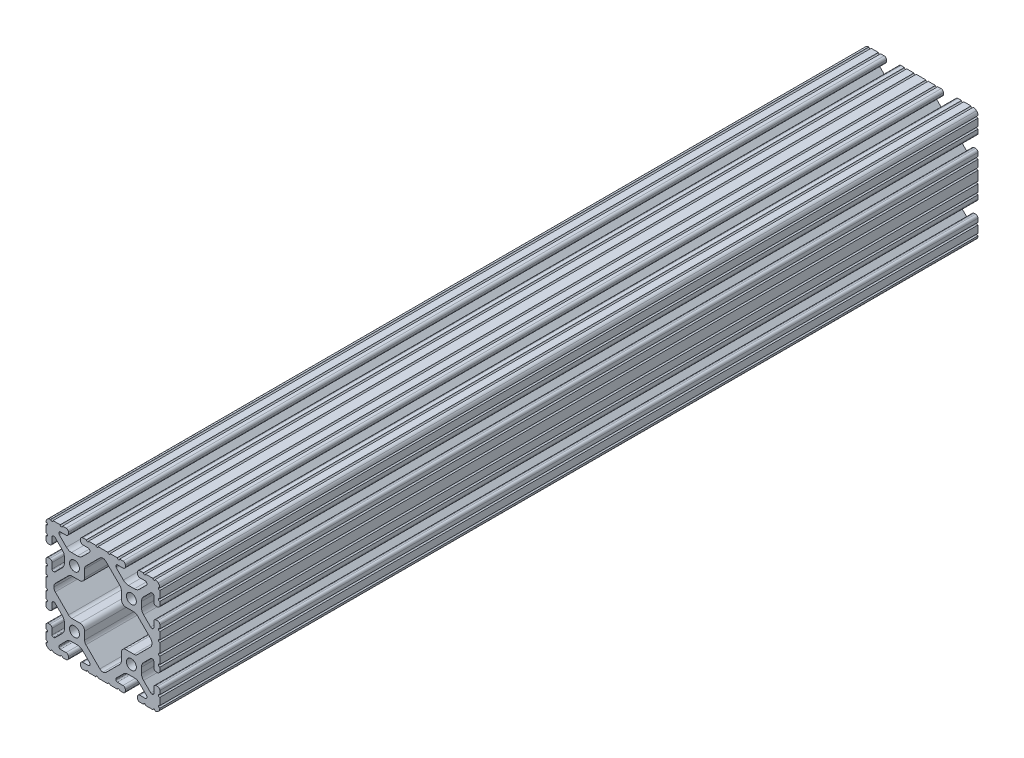
from build123d import *

# Parameters (mm, degrees)
BOSS_EXTRUDE1_DEPTH      = 273.8
BOSS_EXTRUDE1_DEPTH_BACK = 273.8
SKETCH3_R                = 3.3274


with BuildPart() as part:
    # Sketch3 → Boss-Extrude1 (new, two sides: drawn at the far end of the back side and taken through both)
    with BuildSketch(Plane.XY.offset(-BOSS_EXTRUDE1_DEPTH_BACK)):
        with BuildLine():
            Line((34.036, 28.448), (34.036, 24.630196049))
            ThreePointArc((34.036, 24.630196049), (34.497248241, 23.51664429), (35.6108, 23.055396049))
            Line((35.6108, 23.055396049), (36.525200183, 23.055396049))
            ThreePointArc((36.525200183, 23.055396049), (37.638751813, 23.516644236), (38.1, 24.630195866))
            Line((38.1, 24.630195866), (38.1, 27.023826138))
            ThreePointArc((38.1, 27.023826138), (37.117780706, 27.7845421), (38.1, 28.545258062))
            Line((38.1, 28.545258062), (38.1, 33.373016026))
            ThreePointArc((38.1, 33.373016026), (37.141472621, 34.109236774), (38.1, 34.845457521))
            ThreePointArc((38.1, 34.845457521), (37.837757813, 36.120195002), (37.086123144, 37.182631793))
            ThreePointArc((37.086123144, 37.182631793), (36.106286572, 37.843374398), (34.952681874, 38.1))
            ThreePointArc((34.952681874, 38.1), (34.190730434, 37.320215335), (33.428778994, 38.1))
            Line((33.428778994, 38.1), (28.601105935, 38.1))
            ThreePointArc((28.601105935, 38.1), (27.839158581, 37.32021942), (27.077211227, 38.1))
            Line((27.077211227, 38.1), (24.6888, 38.1))
            ThreePointArc((24.6888, 38.1), (23.575248241, 37.638751759), (23.114, 36.5252))
            Line((23.114, 36.5252), (23.114, 35.6108))
            ThreePointArc((23.114, 35.6108), (23.575248241, 34.497248241), (24.6888, 34.036))
            Line((24.6888, 34.036), (28.448, 34.036))
            ThreePointArc((28.448, 34.036), (29.076617928, 33.775617928), (29.337, 33.147))
            Line((29.337, 33.147), (29.337, 32.720693454))
            ThreePointArc((29.337, 32.720693454), (29.326675076, 32.273872751), (29.100231244, 31.888543625))
            Line((29.100231244, 31.888543625), (24.409287499, 27.197588341))
            ThreePointArc((24.409287499, 27.197588341), (22.868340045, 26.167958114), (21.050667579, 25.8064))
            Line((21.050667579, 25.8064), (17.049332421, 25.8064))
            ThreePointArc((17.049332421, 25.8064), (15.231659955, 26.167958114), (13.690712501, 27.197588341))
            Line((13.690712501, 27.197588341), (9.023381298, 31.864931024))
            ThreePointArc((9.023381298, 31.864931024), (8.830670886, 32.153343113), (8.763, 32.493548179))
            Line((8.763, 32.493548179), (8.763, 33.147))
            ThreePointArc((8.763, 33.147), (9.023382072, 33.775617928), (9.652, 34.036))
            Line((9.652, 34.036), (13.4112, 34.036))
            ThreePointArc((13.4112, 34.036), (14.524751759, 34.497248241), (14.986, 35.6108))
            Line((14.986, 35.6108), (14.986, 36.5252))
            ThreePointArc((14.986, 36.5252), (14.524751759, 37.638751759), (13.4112, 38.1))
            Line((13.4112, 38.1), (11.128867074, 38.1))
            ThreePointArc((11.128867074, 38.1), (10.367071033, 37.320370693), (9.605274992, 38.1))
            Line((9.605274992, 38.1), (4.777313069, 38.1))
            ThreePointArc((4.777313069, 38.1), (4.015517029, 37.320370693), (3.253720988, 38.1))
            Line((3.253720988, 38.1), (-3.253720988, 38.1))
            ThreePointArc((-3.253720988, 38.1), (-4.015517029, 37.320370693), (-4.777313069, 38.1))
            Line((-4.777313069, 38.1), (-9.605274992, 38.1))
            ThreePointArc((-9.605274992, 38.1), (-10.367071033, 37.320370693), (-11.128867074, 38.1))
            Line((-11.128867074, 38.1), (-13.4112, 38.1))
            ThreePointArc((-13.4112, 38.1), (-14.524751759, 37.638751759), (-14.986, 36.5252))
            Line((-14.986, 36.5252), (-14.986, 35.6108))
            ThreePointArc((-14.986, 35.6108), (-14.524751759, 34.497248241), (-13.4112, 34.036))
            Line((-13.4112, 34.036), (-9.652, 34.036))
            ThreePointArc((-9.652, 34.036), (-9.023382072, 33.775617928), (-8.763, 33.147))
            Line((-8.763, 33.147), (-8.763, 32.493548179))
            ThreePointArc((-8.763, 32.493548179), (-8.830670886, 32.153343113), (-9.023381298, 31.864931024))
            Line((-9.023381298, 31.864931024), (-13.690712501, 27.197588341))
            ThreePointArc((-13.690712501, 27.197588341), (-15.231659955, 26.167958114), (-17.049332421, 25.8064))
            Line((-17.049332421, 25.8064), (-21.050667579, 25.8064))
            ThreePointArc((-21.050667579, 25.8064), (-22.868340045, 26.167958114), (-24.409287499, 27.197588341))
            Line((-24.409287499, 27.197588341), (-29.100231244, 31.888543625))
            ThreePointArc((-29.100231244, 31.888543625), (-29.326675076, 32.273872751), (-29.337, 32.720693454))
            Line((-29.337, 32.720693454), (-29.337, 33.147))
            ThreePointArc((-29.337, 33.147), (-29.076617928, 33.775617928), (-28.448, 34.036))
            Line((-28.448, 34.036), (-24.6888, 34.036))
            ThreePointArc((-24.6888, 34.036), (-23.575248241, 34.497248241), (-23.114, 35.6108))
            Line((-23.114, 35.6108), (-23.114, 36.5252))
            ThreePointArc((-23.114, 36.5252), (-23.575248241, 37.638751759), (-24.6888, 38.1))
            Line((-24.6888, 38.1), (-27.077211227, 38.1))
            ThreePointArc((-27.077211227, 38.1), (-27.839158581, 37.32021942), (-28.601105935, 38.1))
            Line((-28.601105935, 38.1), (-33.428778994, 38.1))
            ThreePointArc((-33.428778994, 38.1), (-34.190730434, 37.320215335), (-34.952681874, 38.1))
            ThreePointArc((-34.952681874, 38.1), (-36.106286572, 37.843374398), (-37.086123144, 37.182631793))
            ThreePointArc((-37.086123144, 37.182631793), (-37.837757813, 36.120195002), (-38.1, 34.845457521))
            ThreePointArc((-38.1, 34.845457521), (-37.141472621, 34.109236774), (-38.1, 33.373016026))
            Line((-38.1, 33.373016026), (-38.1, 28.545258062))
            ThreePointArc((-38.1, 28.545258062), (-37.117780706, 27.7845421), (-38.1, 27.023826138))
            Line((-38.1, 27.023826138), (-38.1, 24.630195866))
            ThreePointArc((-38.1, 24.630195866), (-37.638751813, 23.516644236), (-36.525200183, 23.055396049))
            Line((-36.525200183, 23.055396049), (-35.6108, 23.055396049))
            ThreePointArc((-35.6108, 23.055396049), (-34.497248241, 23.51664429), (-34.036, 24.630196049))
            Line((-34.036, 24.630196049), (-34.036, 28.448))
            ThreePointArc((-34.036, 28.448), (-33.775617928, 29.076617928), (-33.147, 29.337))
            Line((-33.147, 29.337), (-32.664287242, 29.337))
            ThreePointArc((-32.664287242, 29.337), (-32.324081166, 29.269328695), (-32.03566854, 29.076617155))
            Line((-32.03566854, 29.076617155), (-27.19758008, 24.238516795))
            ThreePointArc((-27.19758008, 24.238516795), (-26.167955879, 22.697572205), (-25.8064, 20.879905136))
            Line((-25.8064, 20.879905136), (-25.8064, 17.220094864))
            ThreePointArc((-25.8064, 17.220094864), (-26.167955879, 15.402427795), (-27.19758008, 13.861483205))
            Line((-27.19758008, 13.861483205), (-31.948944541, 9.110107057))
            ThreePointArc((-31.948944541, 9.110107057), (-32.333417096, 8.853210196), (-32.786933649, 8.763))
            Line((-32.786933649, 8.763), (-33.060275787, 8.763))
            ThreePointArc((-33.060275787, 8.763), (-33.750216995, 9.048783005), (-34.036, 9.738724213))
            Line((-34.036, 9.738724213), (-34.036, 13.469803585))
            ThreePointArc((-34.036, 13.469803585), (-34.497248348, 14.583355603), (-35.610800366, 15.044603951))
            Line((-35.610800366, 15.044603951), (-36.5252, 15.044603951))
            ThreePointArc((-36.5252, 15.044603951), (-37.638751759, 14.58335571), (-38.1, 13.469803951))
            Line((-38.1, 13.469803951), (-38.1, 11.075039289))
            ThreePointArc((-38.1, 11.075039289), (-37.117000248, 10.313517272), (-38.1, 9.551995255))
            Line((-38.1, 9.551995255), (-38.1, 4.723759308))
            ThreePointArc((-38.1, 4.723759308), (-37.117000248, 3.962237292), (-38.1, 3.200715275))
            Line((-38.1, 3.200715275), (-38.1, -3.200715275))
            ThreePointArc((-38.1, -3.200715275), (-37.117000248, -3.962237292), (-38.1, -4.723759308))
            Line((-38.1, -4.723759308), (-38.1, -9.551995255))
            ThreePointArc((-38.1, -9.551995255), (-37.117000248, -10.313517272), (-38.1, -11.075039289))
            Line((-38.1, -11.075039289), (-38.1, -13.469803951))
            ThreePointArc((-38.1, -13.469803951), (-37.638751759, -14.58335571), (-36.5252, -15.044603951))
            Line((-36.5252, -15.044603951), (-35.610800366, -15.044603951))
            ThreePointArc((-35.610800366, -15.044603951), (-34.497248348, -14.583355603), (-34.036, -13.469803585))
            Line((-34.036, -13.469803585), (-34.036, -9.738724213))
            ThreePointArc((-34.036, -9.738724213), (-33.750216995, -9.048783005), (-33.060275787, -8.763))
            Line((-33.060275787, -8.763), (-32.786933649, -8.763))
            ThreePointArc((-32.786933649, -8.763), (-32.333417096, -8.853210196), (-31.948944541, -9.110107057))
            Line((-31.948944541, -9.110107057), (-27.19758008, -13.861483205))
            ThreePointArc((-27.19758008, -13.861483205), (-26.167955879, -15.402427795), (-25.8064, -17.220094864))
            Line((-25.8064, -17.220094864), (-25.8064, -20.879905136))
            ThreePointArc((-25.8064, -20.879905136), (-26.167955879, -22.697572205), (-27.19758008, -24.238516795))
            Line((-27.19758008, -24.238516795), (-32.03566854, -29.076617155))
            ThreePointArc((-32.03566854, -29.076617155), (-32.324081166, -29.269328695), (-32.664287242, -29.337))
            Line((-32.664287242, -29.337), (-33.147, -29.337))
            ThreePointArc((-33.147, -29.337), (-33.775617928, -29.076617928), (-34.036, -28.448))
            Line((-34.036, -28.448), (-34.036, -24.630196049))
            ThreePointArc((-34.036, -24.630196049), (-34.497248241, -23.51664429), (-35.6108, -23.055396049))
            Line((-35.6108, -23.055396049), (-36.525200183, -23.055396049))
            ThreePointArc((-36.525200183, -23.055396049), (-37.638751813, -23.516644236), (-38.1, -24.630195866))
            Line((-38.1, -24.630195866), (-38.1, -27.023826138))
            ThreePointArc((-38.1, -27.023826138), (-37.117780706, -27.7845421), (-38.1, -28.545258062))
            Line((-38.1, -28.545258062), (-38.1, -33.373016026))
            ThreePointArc((-38.1, -33.373016026), (-37.141472621, -34.109236774), (-38.1, -34.845457521))
            ThreePointArc((-38.1, -34.845457521), (-37.837757813, -36.120195002), (-37.086123144, -37.182631793))
            ThreePointArc((-37.086123144, -37.182631793), (-36.106286572, -37.843374398), (-34.952681874, -38.1))
            ThreePointArc((-34.952681874, -38.1), (-34.190730434, -37.320215335), (-33.428778994, -38.1))
            Line((-33.428778994, -38.1), (-28.601105935, -38.1))
            ThreePointArc((-28.601105935, -38.1), (-27.839158581, -37.32021942), (-27.077211227, -38.1))
            Line((-27.077211227, -38.1), (-24.6888, -38.1))
            ThreePointArc((-24.6888, -38.1), (-23.575248241, -37.638751759), (-23.114, -36.5252))
            Line((-23.114, -36.5252), (-23.114, -35.6108))
            ThreePointArc((-23.114, -35.6108), (-23.575248241, -34.497248241), (-24.6888, -34.036))
            Line((-24.6888, -34.036), (-28.448, -34.036))
            ThreePointArc((-28.448, -34.036), (-29.076617928, -33.775617928), (-29.337, -33.147))
            Line((-29.337, -33.147), (-29.337, -32.720693454))
            ThreePointArc((-29.337, -32.720693454), (-29.326675076, -32.273872751), (-29.100231244, -31.888543625))
            Line((-29.100231244, -31.888543625), (-24.409287499, -27.197588341))
            ThreePointArc((-24.409287499, -27.197588341), (-22.868340045, -26.167958114), (-21.050667579, -25.8064))
            Line((-21.050667579, -25.8064), (-17.049332421, -25.8064))
            ThreePointArc((-17.049332421, -25.8064), (-15.231659955, -26.167958114), (-13.690712501, -27.197588341))
            Line((-13.690712501, -27.197588341), (-9.023381298, -31.864931024))
            ThreePointArc((-9.023381298, -31.864931024), (-8.830670886, -32.153343113), (-8.763, -32.493548179))
            Line((-8.763, -32.493548179), (-8.763, -33.147))
            ThreePointArc((-8.763, -33.147), (-9.023382072, -33.775617928), (-9.652, -34.036))
            Line((-9.652, -34.036), (-13.4112, -34.036))
            ThreePointArc((-13.4112, -34.036), (-14.524751759, -34.497248241), (-14.986, -35.6108))
            Line((-14.986, -35.6108), (-14.986, -36.5252))
            ThreePointArc((-14.986, -36.5252), (-14.524751759, -37.638751759), (-13.4112, -38.1))
            Line((-13.4112, -38.1), (-11.128867074, -38.1))
            ThreePointArc((-11.128867074, -38.1), (-10.367071033, -37.320370693), (-9.605274992, -38.1))
            Line((-9.605274992, -38.1), (-4.777313069, -38.1))
            ThreePointArc((-4.777313069, -38.1), (-4.015517029, -37.320370693), (-3.253720988, -38.1))
            Line((-3.253720988, -38.1), (3.253720988, -38.1))
            ThreePointArc((3.253720988, -38.1), (4.015517029, -37.320370693), (4.777313069, -38.1))
            Line((4.777313069, -38.1), (9.605274992, -38.1))
            ThreePointArc((9.605274992, -38.1), (10.367071033, -37.320370693), (11.128867074, -38.1))
            Line((11.128867074, -38.1), (13.4112, -38.1))
            ThreePointArc((13.4112, -38.1), (14.524751759, -37.638751759), (14.986, -36.5252))
            Line((14.986, -36.5252), (14.986, -35.6108))
            ThreePointArc((14.986, -35.6108), (14.524751759, -34.497248241), (13.4112, -34.036))
            Line((13.4112, -34.036), (9.652, -34.036))
            ThreePointArc((9.652, -34.036), (9.023382072, -33.775617928), (8.763, -33.147))
            Line((8.763, -33.147), (8.763, -32.493548179))
            ThreePointArc((8.763, -32.493548179), (8.830670886, -32.153343113), (9.023381298, -31.864931024))
            Line((9.023381298, -31.864931024), (13.690712501, -27.197588341))
            ThreePointArc((13.690712501, -27.197588341), (15.231659955, -26.167958114), (17.049332421, -25.8064))
            Line((17.049332421, -25.8064), (21.050667579, -25.8064))
            ThreePointArc((21.050667579, -25.8064), (22.868340045, -26.167958114), (24.409287499, -27.197588341))
            Line((24.409287499, -27.197588341), (29.100231244, -31.888543625))
            ThreePointArc((29.100231244, -31.888543625), (29.326675076, -32.273872751), (29.337, -32.720693454))
            Line((29.337, -32.720693454), (29.337, -33.147))
            ThreePointArc((29.337, -33.147), (29.076617928, -33.775617928), (28.448, -34.036))
            Line((28.448, -34.036), (24.6888, -34.036))
            ThreePointArc((24.6888, -34.036), (23.575248241, -34.497248241), (23.114, -35.6108))
            Line((23.114, -35.6108), (23.114, -36.5252))
            ThreePointArc((23.114, -36.5252), (23.575248241, -37.638751759), (24.6888, -38.1))
            Line((24.6888, -38.1), (27.077211227, -38.1))
            ThreePointArc((27.077211227, -38.1), (27.839158581, -37.32021942), (28.601105935, -38.1))
            Line((28.601105935, -38.1), (33.428778994, -38.1))
            ThreePointArc((33.428778994, -38.1), (34.190730434, -37.320215335), (34.952681874, -38.1))
            ThreePointArc((34.952681874, -38.1), (36.106286572, -37.843374398), (37.086123144, -37.182631793))
            ThreePointArc((37.086123144, -37.182631793), (37.837757813, -36.120195002), (38.1, -34.845457521))
            ThreePointArc((38.1, -34.845457521), (37.141472621, -34.109236774), (38.1, -33.373016026))
            Line((38.1, -33.373016026), (38.1, -28.545258062))
            ThreePointArc((38.1, -28.545258062), (37.117780706, -27.7845421), (38.1, -27.023826138))
            Line((38.1, -27.023826138), (38.1, -24.630195866))
            ThreePointArc((38.1, -24.630195866), (37.638751813, -23.516644236), (36.525200183, -23.055396049))
            Line((36.525200183, -23.055396049), (35.6108, -23.055396049))
            ThreePointArc((35.6108, -23.055396049), (34.497248241, -23.51664429), (34.036, -24.630196049))
            Line((34.036, -24.630196049), (34.036, -28.448))
            ThreePointArc((34.036, -28.448), (33.775617928, -29.076617928), (33.147, -29.337))
            Line((33.147, -29.337), (32.664287242, -29.337))
            ThreePointArc((32.664287242, -29.337), (32.324081166, -29.269328695), (32.03566854, -29.076617155))
            Line((32.03566854, -29.076617155), (27.19758008, -24.238516795))
            ThreePointArc((27.19758008, -24.238516795), (26.167955879, -22.697572205), (25.8064, -20.879905136))
            Line((25.8064, -20.879905136), (25.8064, -17.220094864))
            ThreePointArc((25.8064, -17.220094864), (26.167955879, -15.402427795), (27.19758008, -13.861483205))
            Line((27.19758008, -13.861483205), (31.948944541, -9.110107057))
            ThreePointArc((31.948944541, -9.110107057), (32.333417096, -8.853210196), (32.786933649, -8.763))
            Line((32.786933649, -8.763), (33.060275787, -8.763))
            ThreePointArc((33.060275787, -8.763), (33.750216995, -9.048783005), (34.036, -9.738724213))
            Line((34.036, -9.738724213), (34.036, -13.469803585))
            ThreePointArc((34.036, -13.469803585), (34.497248348, -14.583355603), (35.610800366, -15.044603951))
            Line((35.610800366, -15.044603951), (36.5252, -15.044603951))
            ThreePointArc((36.5252, -15.044603951), (37.638751759, -14.58335571), (38.1, -13.469803951))
            Line((38.1, -13.469803951), (38.1, -11.075039289))
            ThreePointArc((38.1, -11.075039289), (37.117000248, -10.313517272), (38.1, -9.551995255))
            Line((38.1, -9.551995255), (38.1, -4.723759308))
            ThreePointArc((38.1, -4.723759308), (37.117000248, -3.962237292), (38.1, -3.200715275))
            Line((38.1, -3.200715275), (38.1, 3.200715275))
            ThreePointArc((38.1, 3.200715275), (37.117000248, 3.962237292), (38.1, 4.723759308))
            Line((38.1, 4.723759308), (38.1, 9.551995255))
            ThreePointArc((38.1, 9.551995255), (37.117000248, 10.313517272), (38.1, 11.075039289))
            Line((38.1, 11.075039289), (38.1, 13.469803951))
            ThreePointArc((38.1, 13.469803951), (37.638751759, 14.58335571), (36.5252, 15.044603951))
            Line((36.5252, 15.044603951), (35.610800366, 15.044603951))
            ThreePointArc((35.610800366, 15.044603951), (34.497248348, 14.583355603), (34.036, 13.469803585))
            Line((34.036, 13.469803585), (34.036, 9.738724213))
            ThreePointArc((34.036, 9.738724213), (33.750216995, 9.048783005), (33.060275787, 8.763))
            Line((33.060275787, 8.763), (32.786933649, 8.763))
            ThreePointArc((32.786933649, 8.763), (32.333417096, 8.853210196), (31.948944541, 9.110107057))
            Line((31.948944541, 9.110107057), (27.19758008, 13.861483205))
            ThreePointArc((27.19758008, 13.861483205), (26.167955879, 15.402427795), (25.8064, 17.220094864))
            Line((25.8064, 17.220094864), (25.8064, 20.879905136))
            ThreePointArc((25.8064, 20.879905136), (26.167955879, 22.697572205), (27.19758008, 24.238516795))
            Line((27.19758008, 24.238516795), (32.03566854, 29.076617155))
            ThreePointArc((32.03566854, 29.076617155), (32.324081166, 29.269328695), (32.664287242, 29.337))
            Line((32.664287242, 29.337), (33.147, 29.337))
            ThreePointArc((33.147, 29.337), (33.775617928, 29.076617928), (34.036, 28.448))
        make_face()
        with Locations((19.05, 19.05)):
            Circle(SKETCH3_R, mode=Mode.SUBTRACT)
        with Locations((-19.05, 19.05)):
            Circle(SKETCH3_R, mode=Mode.SUBTRACT)
        with Locations((19.05, -19.05)):
            Circle(SKETCH3_R, mode=Mode.SUBTRACT)
        with Locations((-19.05, -19.05)):
            Circle(SKETCH3_R, mode=Mode.SUBTRACT)
        with BuildLine():
            Line((-11.363666791, -22.843321003), (-2.051515952, -32.155494748))
            ThreePointArc((-2.051515952, -32.155494748), (-1.11031328, -32.786013752), (0, -33.011005091))
            ThreePointArc((0, -33.011005091), (1.11031328, -32.786013752), (2.051515952, -32.155494748))
            Line((2.051515952, -32.155494748), (11.363666791, -22.843321003))
            ThreePointArc((11.363666791, -22.843321003), (12.051918263, -21.813277828), (12.2936, -20.598259734))
            Line((12.2936, -20.598259734), (12.2936, -15.4686))
            ThreePointArc((12.2936, -15.4686), (13.22353597, -13.22353597), (15.4686, -12.2936))
            Line((15.4686, -12.2936), (20.769026744, -12.2936))
            ThreePointArc((20.769026744, -12.2936), (21.984048446, -12.051916769), (23.014093535, -11.363661269))
            Line((23.014093535, -11.363661269), (31.902125566, -2.475607377))
            ThreePointArc((31.902125566, -2.475607377), (32.607298578, -1.335259481), (32.728725173, 0))
            ThreePointArc((32.728725173, 0), (32.607298578, 1.335259481), (31.902125566, 2.475607377))
            Line((31.902125566, 2.475607377), (23.014093535, 11.363661269))
            ThreePointArc((23.014093535, 11.363661269), (21.984048446, 12.051916769), (20.769026744, 12.2936))
            Line((20.769026744, 12.2936), (15.4686, 12.2936))
            ThreePointArc((15.4686, 12.2936), (13.22353597, 13.22353597), (12.2936, 15.4686))
            Line((12.2936, 15.4686), (12.2936, 20.598259734))
            ThreePointArc((12.2936, 20.598259734), (12.051918263, 21.813277828), (11.363666791, 22.843321003))
            Line((11.363666791, 22.843321003), (2.051515952, 32.155494748))
            ThreePointArc((2.051515952, 32.155494748), (1.11031328, 32.786013752), (0, 33.011005091))
            ThreePointArc((0, 33.011005091), (-1.11031328, 32.786013752), (-2.051515952, 32.155494748))
            Line((-2.051515952, 32.155494748), (-11.363666791, 22.843321003))
            ThreePointArc((-11.363666791, 22.843321003), (-12.051918263, 21.813277828), (-12.2936, 20.598259734))
            Line((-12.2936, 20.598259734), (-12.2936, 15.4686))
            ThreePointArc((-12.2936, 15.4686), (-13.22353597, 13.22353597), (-15.4686, 12.2936))
            Line((-15.4686, 12.2936), (-20.769026744, 12.2936))
            ThreePointArc((-20.769026744, 12.2936), (-21.984048446, 12.051916769), (-23.014093535, 11.363661269))
            Line((-23.014093535, 11.363661269), (-31.902125566, 2.475607377))
            ThreePointArc((-31.902125566, 2.475607377), (-32.607298578, 1.335259481), (-32.728725173, 0))
            ThreePointArc((-32.728725173, 0), (-32.607298578, -1.335259481), (-31.902125566, -2.475607377))
            Line((-31.902125566, -2.475607377), (-23.014093535, -11.363661269))
            ThreePointArc((-23.014093535, -11.363661269), (-21.984048446, -12.051916769), (-20.769026744, -12.2936))
            Line((-20.769026744, -12.2936), (-15.4686, -12.2936))
            ThreePointArc((-15.4686, -12.2936), (-13.22353597, -13.22353597), (-12.2936, -15.4686))
            Line((-12.2936, -15.4686), (-12.2936, -20.598259734))
            ThreePointArc((-12.2936, -20.598259734), (-12.051918263, -21.813277828), (-11.363666791, -22.843321003))
        make_face(mode=Mode.SUBTRACT)
    extrude(amount=BOSS_EXTRUDE1_DEPTH + BOSS_EXTRUDE1_DEPTH_BACK)


solid = part.part
